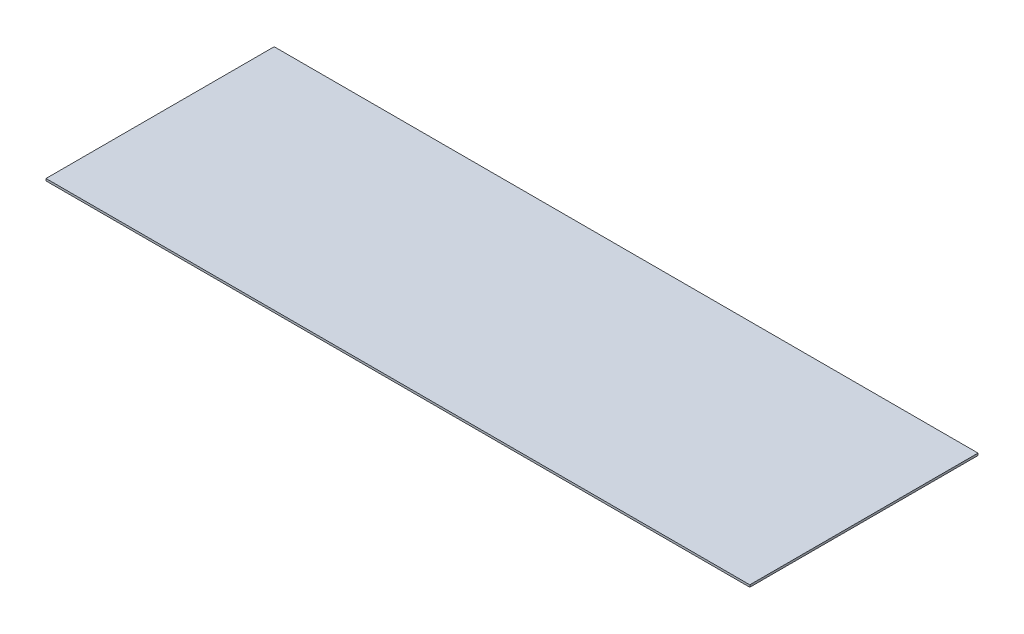
from build123d import *

# Parameters (mm, degrees)
SKETCH_1_W      = 987
SKETCH_1_H      = 320
EXTRUDE_1_DEPTH = 3


with BuildPart() as part:
    # 草图1 → 凸台-拉伸1 (new body)
    with BuildSketch(Plane(origin=(0, 0, 0), x_dir=(1, 0, 0), z_dir=(0, 1, 0))):
        Rectangle(SKETCH_1_W, SKETCH_1_H)
    extrude(amount=EXTRUDE_1_DEPTH)


solid = part.part
